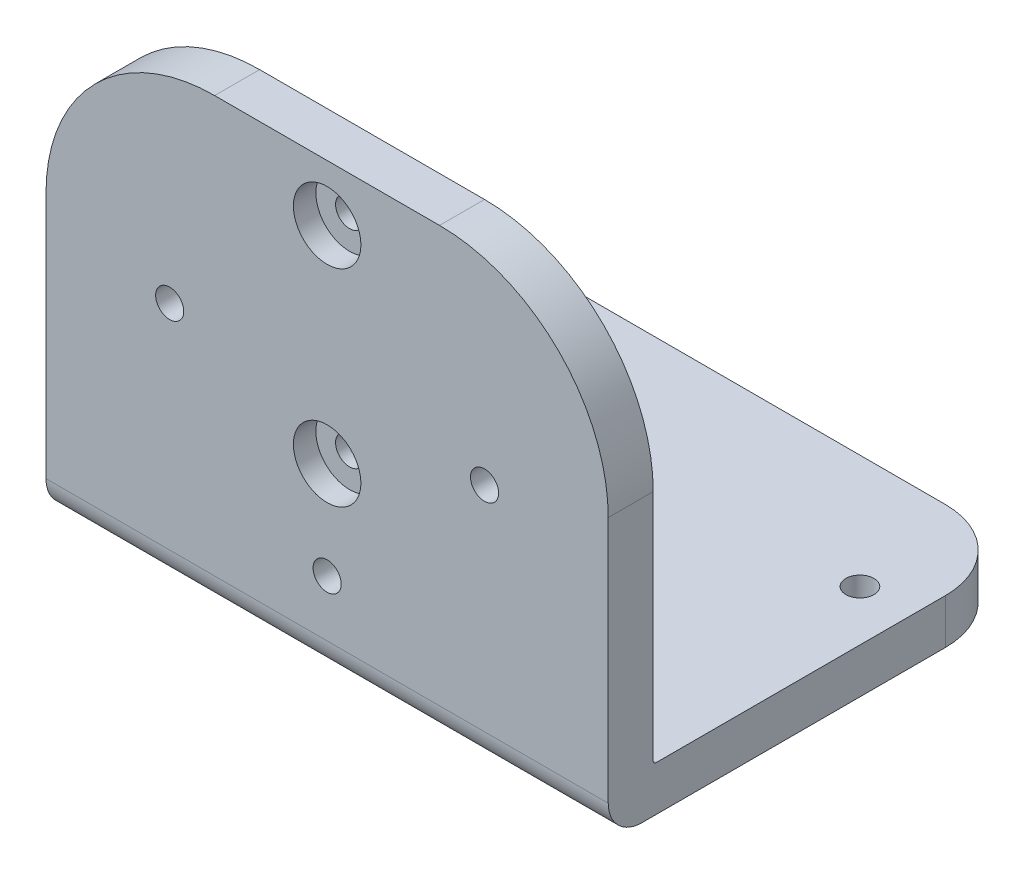
from build123d import *

# Parameters (mm, degrees)
RESSALTO_EXTRUS_O1_DEPTH = 25
CORTE_EXTRUS_O1_START    = -4
ESBO_O2_R                = 3
ESBO_O2_R_2              = 1.25
CORTE_EXTRUS_O1_DEPTH    = 2
ESBO_O2_5_R              = 1.25
CORTE_EXTRUS_O2_DEPTH    = 58.358521599
ESBO_O2_6_R              = 1.25
CORTE_EXTRUS_O3_DEPTH    = 58.358521599
ESBO_O4_R                = 3
ESBO_O4_R_2              = 1.25
CORTE_EXTRUS_O4_DEPTH    = 2
ESBO_O4_4_R              = 1.25
CORTE_EXTRUS_O5_DEPTH    = 58.567351858
CORTE_EXTRUS_O8_START    = -4
CORTE_EXTRUS_O8_DEPTH    = 2
CORTE_EXTRUS_O9_DEPTH    = 58.567351858
FILETE1_R                = 15
FILETE2_R                = 7
FILETE3_R                = 0.25
FILETE4_R                = 3


with BuildPart() as part:
    # Esboço1 → Ressalto-extrusão1 (new, symmetric)
    with BuildSketch(Plane(origin=(0, 0, 0), x_dir=(0, 0, -1), z_dir=(1, 0, 0))):
        Polygon((0, 0), (37, 0), (37, 4), (4, 4), (4, 40), (0, 40), align=None)
    extrude(amount=RESSALTO_EXTRUS_O1_DEPTH, both=True)

    # Esboço2 → Corte-extrusão1 (cut)
    # profile 1 of 2: a face of its own
    with BuildSketch(Plane(origin=(0, 4, 0), x_dir=(1, 0, 0), z_dir=(0, 1, 0)).offset(CORTE_EXTRUS_O1_START)):
        with Locations(Location((20.5, 26.88, 0), (0, 0, 90))):
            Circle(ESBO_O2_R)
        with Locations(Location((20.5, 26.88, 0), (0, 0, 90))):
            Circle(ESBO_O2_R_2, mode=Mode.SUBTRACT)
    # profile 2 of 2: a face of its own
    with BuildSketch(Plane(origin=(0, 4, 0), x_dir=(1, 0, 0), z_dir=(0, 1, 0)).offset(CORTE_EXTRUS_O1_START)):
        with Locations(Location((-15.5, 26.88, 0), (0, 0, 90))):
            Circle(ESBO_O2_R)
        with Locations(Location((-15.5, 26.88, 0), (0, 0, 90))):
            Circle(ESBO_O2_R_2, mode=Mode.SUBTRACT)
    extrude(amount=CORTE_EXTRUS_O1_DEPTH, mode=Mode.SUBTRACT)

    # Esboço2<5> → Corte-extrusão2 (cut, through all)
    with BuildSketch(Plane(origin=(0, 4, 0), x_dir=(1, 0, 0), z_dir=(0, 1, 0))):
        with Locations(Location((-15.5, 26.88, 0), (0, 0, 270))):
            Circle(ESBO_O2_5_R)
    extrude(amount=-CORTE_EXTRUS_O2_DEPTH, mode=Mode.SUBTRACT)

    # Esboço2<6> → Corte-extrusão3 (cut, through all)
    with BuildSketch(Plane(origin=(0, 4, 0), x_dir=(1, 0, 0), z_dir=(0, 1, 0))):
        with Locations(Location((20.5, 26.88, 0), (0, 0, 270))):
            Circle(ESBO_O2_6_R)
    extrude(amount=-CORTE_EXTRUS_O3_DEPTH, mode=Mode.SUBTRACT)

    # Esboço4 → Corte-extrusão4 (cut)
    # profile 1 of 6: a face of its own
    with BuildSketch(Plane(origin=(0, 0, -4), x_dir=(-1, 0, 0), z_dir=(0, 0, -1))):
        with Locations(Location((14, 22, 0), (0, 0, 90))):
            Circle(ESBO_O4_R)
        with Locations(Location((14, 22, 0), (0, 0, 90))):
            Circle(ESBO_O4_R_2, mode=Mode.SUBTRACT)
    # profile 2 of 6: a face of its own
    with BuildSketch(Plane(origin=(0, 0, -4), x_dir=(-1, 0, 0), z_dir=(0, 0, -1))):
        with Locations(Location((-14, 22, 0), (0, 0, 90))):
            Circle(ESBO_O4_R)
        with Locations(Location((-14, 22, 0), (0, 0, 90))):
            Circle(ESBO_O4_R_2, mode=Mode.SUBTRACT)
    # profile 3 of 6: a face of its own
    with BuildSketch(Plane(origin=(0, 0, -4), x_dir=(-1, 0, 0), z_dir=(0, 0, -1))):
        with BuildLine():
            ThreePointArc((3, 8), (2.121320344, 10.121320344), (0, 11))
            Line((0, 11), (0, 9.25))
            ThreePointArc((0, 9.25), (0.883883476, 8.883883476), (1.25, 8))
            ThreePointArc((1.25, 8), (0.883883476, 7.116116524), (0, 6.75))
            Line((0, 6.75), (0, 5))
            ThreePointArc((0, 5), (2.121320344, 5.878679656), (3, 8))
        make_face()
    # profile 4 of 6: a face of its own
    with BuildSketch(Plane(origin=(0, 0, -4), x_dir=(-1, 0, 0), z_dir=(0, 0, -1))):
        with BuildLine():
            Line((0, 9.25), (0, 11))
            ThreePointArc((0, 11), (-3, 8), (0, 5))
            Line((0, 5), (0, 6.75))
            ThreePointArc((0, 6.75), (-1.25, 8), (0, 9.25))
        make_face()
    # profile 5 of 6: a face of its own
    with BuildSketch(Plane(origin=(0, 0, -4), x_dir=(-1, 0, 0), z_dir=(0, 0, -1))):
        with BuildLine():
            ThreePointArc((3, 8), (2.121320344, 10.121320344), (0, 11))
            Line((0, 11), (0, 9.25))
            ThreePointArc((0, 9.25), (0.883883476, 8.883883476), (1.25, 8))
            ThreePointArc((1.25, 8), (0.883883476, 7.116116524), (0, 6.75))
            Line((0, 6.75), (0, 5))
            ThreePointArc((0, 5), (2.121320344, 5.878679656), (3, 8))
        make_face()
    # profile 6 of 6: a face of its own
    with BuildSketch(Plane(origin=(0, 0, -4), x_dir=(-1, 0, 0), z_dir=(0, 0, -1))):
        with BuildLine():
            Line((0, 9.25), (0, 11))
            ThreePointArc((0, 11), (-3, 8), (0, 5))
            Line((0, 5), (0, 6.75))
            ThreePointArc((0, 6.75), (-1.25, 8), (0, 9.25))
        make_face()
    extrude(amount=-CORTE_EXTRUS_O4_DEPTH, mode=Mode.SUBTRACT)

    # Esboço4<4> → Corte-extrusão5 (cut, through all)
    with BuildSketch(Plane(origin=(0, 0, -4), x_dir=(-1, 0, 0), z_dir=(0, 0, -1))):
        with Locations(Location((-14, 22, 0), (0, 0, 90))):
            Circle(ESBO_O4_4_R)
        with Locations(Location((14, 22, 0), (0, 0, 90))):
            Circle(ESBO_O4_4_R)
        with BuildLine():
            ThreePointArc((1.25, 8), (0.883883476, 8.883883476), (0, 9.25))
            Line((0, 9.25), (0, 6.75))
            ThreePointArc((0, 6.75), (0.883883476, 7.116116524), (1.25, 8))
        make_face()
        with BuildLine():
            Line((0, 6.75), (0, 9.25))
            ThreePointArc((0, 9.25), (-1.25, 8), (0, 6.75))
        make_face()
    extrude(amount=-CORTE_EXTRUS_O5_DEPTH, mode=Mode.SUBTRACT)

    # Esboço4<11> → Corte-extrusão8 (cut)
    with BuildSketch(Plane(origin=(0, 0, -4), x_dir=(-1, 0, 0), z_dir=(0, 0, -1)).offset(CORTE_EXTRUS_O8_START)):
        with BuildLine():
            ThreePointArc((3, 16.65), (2.121320344, 18.771320344), (0, 19.65))
            Line((0, 19.65), (0, 17.9))
            ThreePointArc((0, 17.9), (0.883883476, 17.533883476), (1.25, 16.65))
            ThreePointArc((1.25, 16.65), (0.883883476, 15.766116524), (0, 15.4))
            Line((0, 15.4), (0, 13.65))
            ThreePointArc((0, 13.65), (2.121320344, 14.528679656), (3, 16.65))
        make_face()
        with BuildLine():
            Line((0, 17.9), (0, 19.65))
            ThreePointArc((0, 19.65), (-3, 16.65), (0, 13.65))
            Line((0, 13.65), (0, 15.4))
            ThreePointArc((0, 15.4), (-1.25, 16.65), (0, 17.9))
        make_face()
        with BuildLine():
            ThreePointArc((3, 35), (2.121320344, 37.121320344), (0, 38))
            Line((0, 38), (0, 36.25))
            ThreePointArc((0, 36.25), (0.883883476, 35.883883476), (1.25, 35))
            ThreePointArc((1.25, 35), (0.883883476, 34.116116524), (0, 33.75))
            Line((0, 33.75), (0, 32))
            ThreePointArc((0, 32), (2.121320344, 32.878679656), (3, 35))
        make_face()
        with BuildLine():
            Line((0, 36.25), (0, 38))
            ThreePointArc((0, 38), (-3, 35), (0, 32))
            Line((0, 32), (0, 33.75))
            ThreePointArc((0, 33.75), (-1.25, 35), (0, 36.25))
        make_face()
    extrude(amount=CORTE_EXTRUS_O8_DEPTH, mode=Mode.SUBTRACT)

    # Esboço4<12> → Corte-extrusão9 (cut, through all)
    with BuildSketch(Plane(origin=(0, 0, -4), x_dir=(-1, 0, 0), z_dir=(0, 0, -1))):
        with BuildLine():
            ThreePointArc((1.25, 35), (0.883883476, 35.883883476), (0, 36.25))
            Line((0, 36.25), (0, 33.75))
            ThreePointArc((0, 33.75), (0.883883476, 34.116116524), (1.25, 35))
        make_face()
        with BuildLine():
            Line((0, 33.75), (0, 36.25))
            ThreePointArc((0, 36.25), (-1.25, 35), (0, 33.75))
        make_face()
        with BuildLine():
            ThreePointArc((1.25, 16.65), (0.883883476, 17.533883476), (0, 17.9))
            Line((0, 17.9), (0, 15.4))
            ThreePointArc((0, 15.4), (0.883883476, 15.766116524), (1.25, 16.65))
        make_face()
        with BuildLine():
            Line((0, 15.4), (0, 17.9))
            ThreePointArc((0, 17.9), (-1.25, 16.65), (0, 15.4))
        make_face()
    extrude(amount=-CORTE_EXTRUS_O9_DEPTH, mode=Mode.SUBTRACT)

    # Filete1
    filete1_edges = [part.edges().sort_by_distance(p)[0] for p in [
        (25, 40, -2),
        (-25, 40, -2),
    ]]
    fillet(filete1_edges, radius=FILETE1_R)

    # Filete2
    filete2_edges = [part.edges().sort_by_distance(p)[0] for p in [
        (25, 2, -37),
        (-25, 2, -37),
    ]]
    fillet(filete2_edges, radius=FILETE2_R)

    # Filete3
    filete3_edges = [part.edges().sort_by_distance(p)[0] for p in [
        (0, 4, -4),
    ]]
    fillet(filete3_edges, radius=FILETE3_R)

    # Filete4
    filete4_edges = [part.edges().sort_by_distance(p)[0] for p in [
        (0, 0, 0),
    ]]
    fillet(filete4_edges, radius=FILETE4_R)


solid = part.part
